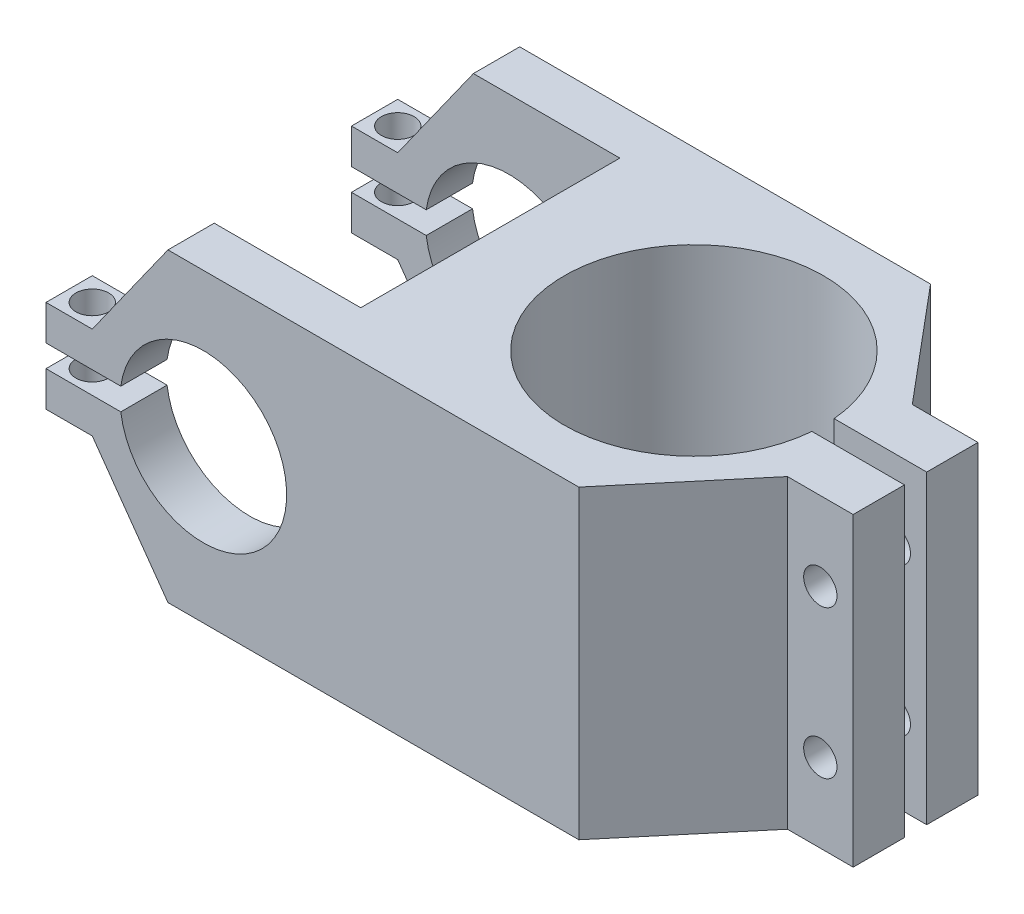
from build123d import *

# Parameters (mm, degrees)
BOSS_EXTRUDE1_DEPTH = 41.91
SKETCH2_R           = 11.43
CUT_EXTRUDE1_DEPTH  = 56.388
SKETCH3_W           = 21.064654828
SKETCH3_H           = 1.524
CUT_EXTRUDE3_DEPTH  = 56.388
SKETCH4_R           = 2.2499955
CUT_EXTRUDE4_DEPTH  = 56.388
SKETCH5_R           = 2.286
CUT_EXTRUDE5_DEPTH  = 56.388


with BuildPart() as part:
    # Sketch1 → Boss-Extrude1 (new body)
    with BuildSketch(Plane(origin=(0, 0, 0), x_dir=(1, 0, 0), z_dir=(0, 1, 0))):
        with BuildLine():
            Line((-121.13336204, 24.13), (-48.027058794, 24.13))
            Line((-48.027058794, 24.13), (-34.965614565, 8.563976916))
            Line((-34.965614565, 8.563976916), (-25.948796733, 8.563976916))
            Line((-25.948796733, 8.563976916), (-25.948796733, 1.524))
            Line((-25.948796733, 1.524), (-38.648796733, 1.524))
            ThreePointArc((-38.648796733, 1.524), (-74.14336204, 0), (-38.648796733, -1.524))
            Line((-38.648796733, -1.524), (-25.948796733, -1.524))
            Line((-25.948796733, -1.524), (-25.948796733, -8.563976916))
            Line((-25.948796733, -8.563976916), (-34.965614565, -8.563976916))
            Line((-34.965614565, -8.563976916), (-48.027058794, -24.13))
            Line((-48.027058794, -24.13), (-121.13336204, -24.13))
            Line((-121.13336204, -24.13), (-121.13336204, -17.78))
            Line((-121.13336204, -17.78), (-84.30336204, -17.78))
            Line((-84.30336204, -17.78), (-84.30336204, 17.78))
            Line((-84.30336204, 17.78), (-121.13336204, 17.78))
            Line((-121.13336204, 17.78), (-121.13336204, 24.13))
        make_face()
    extrude(amount=BOSS_EXTRUDE1_DEPTH)

    # Sketch2 → Cut-Extrude1 (cut)
    with BuildSketch(Plane.XY.offset(24.13)):
        with Locations((-99.54336204, 20.955)):
            Circle(SKETCH2_R)
    extrude(amount=-CUT_EXTRUDE1_DEPTH, mode=Mode.SUBTRACT)

    # Sketch3 → Cut-Extrude3 (cut)
    with BuildSketch(Plane.XY.offset(24.13)):
        Polygon((-121.13336204, 14.605), (-114.78336204, 14.605), (-104.400968543, 0), (-121.13336204, 0), align=None)
        Polygon((-104.400968543, 41.91), (-121.13336204, 41.91), (-121.13336204, 27.305), (-114.78336204, 27.305), align=None)
        with Locations((-110.601034626, 20.193)):
            Rectangle(SKETCH3_W, SKETCH3_H)
        with Locations((-110.601034626, 21.717)):
            Rectangle(SKETCH3_W, SKETCH3_H)
    extrude(amount=-CUT_EXTRUDE3_DEPTH, mode=Mode.SUBTRACT)

    # Sketch4 → Cut-Extrude4 (cut)
    with BuildSketch(Plane(origin=(0, 27.305, 0), x_dir=(1, 0, 0), z_dir=(0, 1, 0))):
        with Locations(Location((-117.95836204, 20.955, 0), (0, 0, 180))):
            Circle(SKETCH4_R)
        with Locations(Location((-117.95836204, -20.955, 0), (0, 0, 180))):
            Circle(SKETCH4_R)
    extrude(amount=-CUT_EXTRUDE4_DEPTH, mode=Mode.SUBTRACT)

    # Sketch5 → Cut-Extrude5 (cut)
    with BuildSketch(Plane.XY.offset(8.563976916)):
        with Locations((-30.457205649, 31.115)):
            Circle(SKETCH5_R)
        with Locations((-30.457205649, 10.795)):
            Circle(SKETCH5_R)
    extrude(amount=-CUT_EXTRUDE5_DEPTH, mode=Mode.SUBTRACT)


solid = part.part
